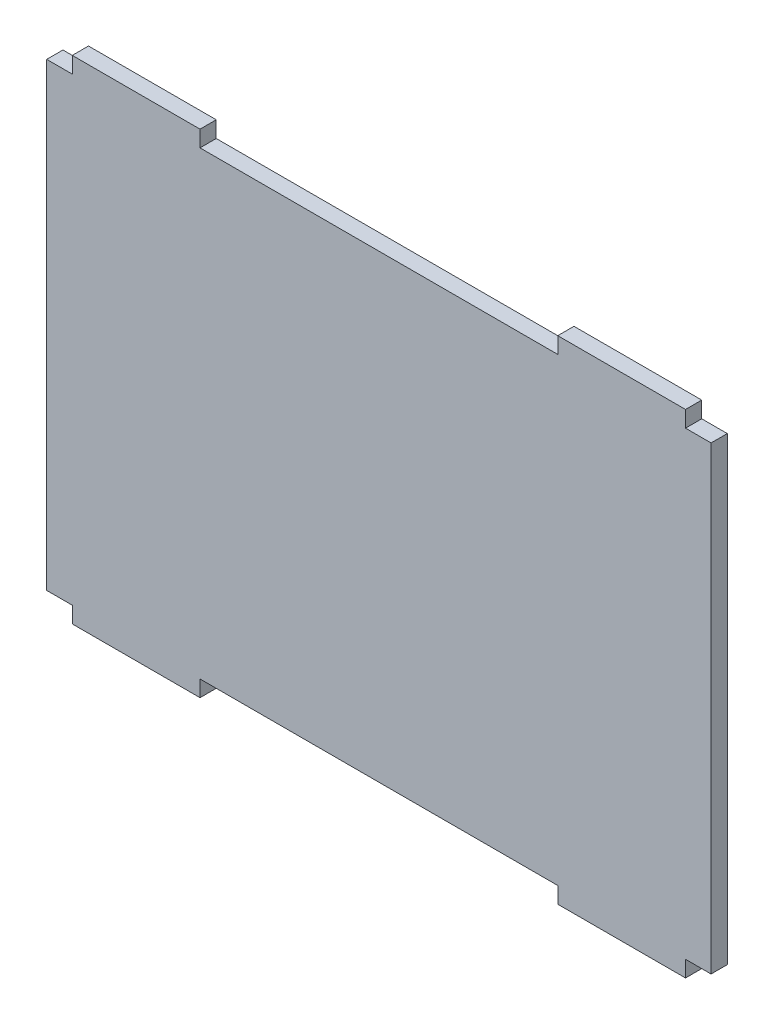
from build123d import *

# Parameters (mm, degrees)
BOSS_EXTRUDE1_DEPTH = 3.175


with BuildPart() as part:
    # Sketch1 → Boss-Extrude1 (new body)
    with BuildSketch(Plane.XY):
        Polygon((5, 0), (5, -3.175), (30, -3.175), (30, 0), (100, 0), (100, -3.175), (125, -3.175), (125, 0), (130, 0), (130, 90), (125, 90), (125, 93.175), (100, 93.175), (100, 90), (30, 90), (30, 93.175), (5, 93.175), (5, 90), (0, 90), (0, 0), align=None)
    extrude(amount=BOSS_EXTRUDE1_DEPTH)


solid = part.part
